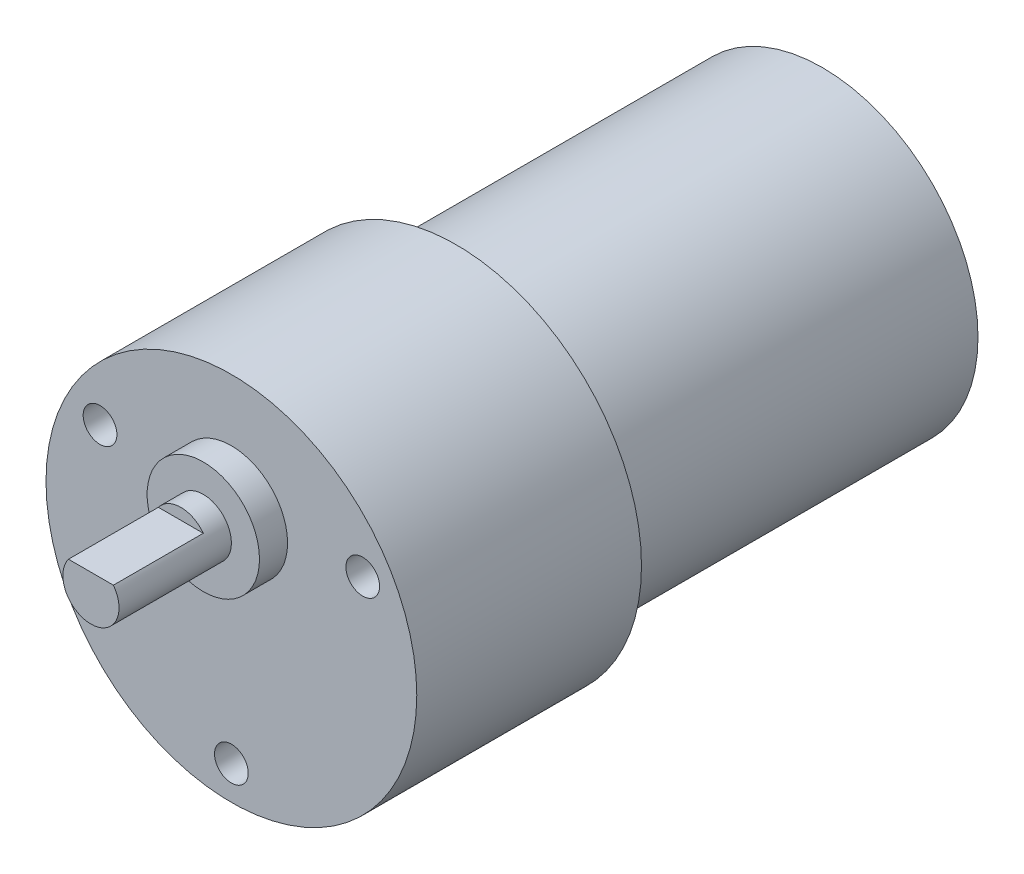
from build123d import *

# Parameters (mm, degrees)
SKETCH6_R           = 5
BOSS_EXTRUDE3_DEPTH = 2.5
SKETCH7_R           = 2.5
BOSS_EXTRUDE4_DEPTH = 10
CUT_EXTRUDE1_START  = -8
CUT_EXTRUDE1_DEPTH  = 8
SKETCH9_R           = 1.500000048
CUT_EXTRUDE2_DEPTH  = 5


with BuildPart() as part:
    # Sketch5 → Revolve1 (revolve)
    with BuildSketch(Plane(origin=(0, 0, 0), x_dir=(0, 0, -1), z_dir=(1, 0, 0)), mode=Mode.PRIVATE) as revolve1_sk:
        Polygon((0, 0), (0, 16.5), (20, 16.5), (20, 13.85), (52.6, 13.85), (52.6, 5), (54.8, 5), (54.8, 1.15), (58.1, 1.15), (58.1, 0), align=None)
    revolve(revolve1_sk.sketch.rotate(Axis((0, 0, 0), (0, 0, 1)), 90), axis=Axis((0, 0, 0), (0, 0, 1)))

    # Sketch6 → Boss-Extrude3 (add)
    with BuildSketch(Plane.XY):
        with Locations((0, 6)):
            Circle(SKETCH6_R)
    extrude(amount=BOSS_EXTRUDE3_DEPTH)

    # Sketch7 → Boss-Extrude4 (add)
    with BuildSketch(Plane.XY.offset(2.5)):
        with Locations((0, 6)):
            Circle(SKETCH7_R)
    extrude(amount=BOSS_EXTRUDE4_DEPTH)

    # Sketch8 → Cut-Extrude1 (cut)
    with BuildSketch(Plane.XY.offset(12.5).offset(CUT_EXTRUDE1_START)):
        with BuildLine():
            Line((-1.999999964, 7.500000048), (1.999999964, 7.500000048))
            ThreePointArc((1.999999964, 7.500000048), (0, 8.5), (-1.999999964, 7.500000048))
        make_face()
    extrude(amount=CUT_EXTRUDE1_DEPTH, mode=Mode.SUBTRACT)

    # Sketch9 → Cut-Extrude2 (cut)
    with BuildSketch(Plane.XY):
        with Locations((0, -13.5)):
            Circle(SKETCH9_R)
        with Locations((-11.691342951, 6.75)):
            Circle(SKETCH9_R)
        with Locations((11.691342951, 6.75)):
            Circle(SKETCH9_R)
    extrude(amount=-CUT_EXTRUDE2_DEPTH, mode=Mode.SUBTRACT)


solid = part.part
